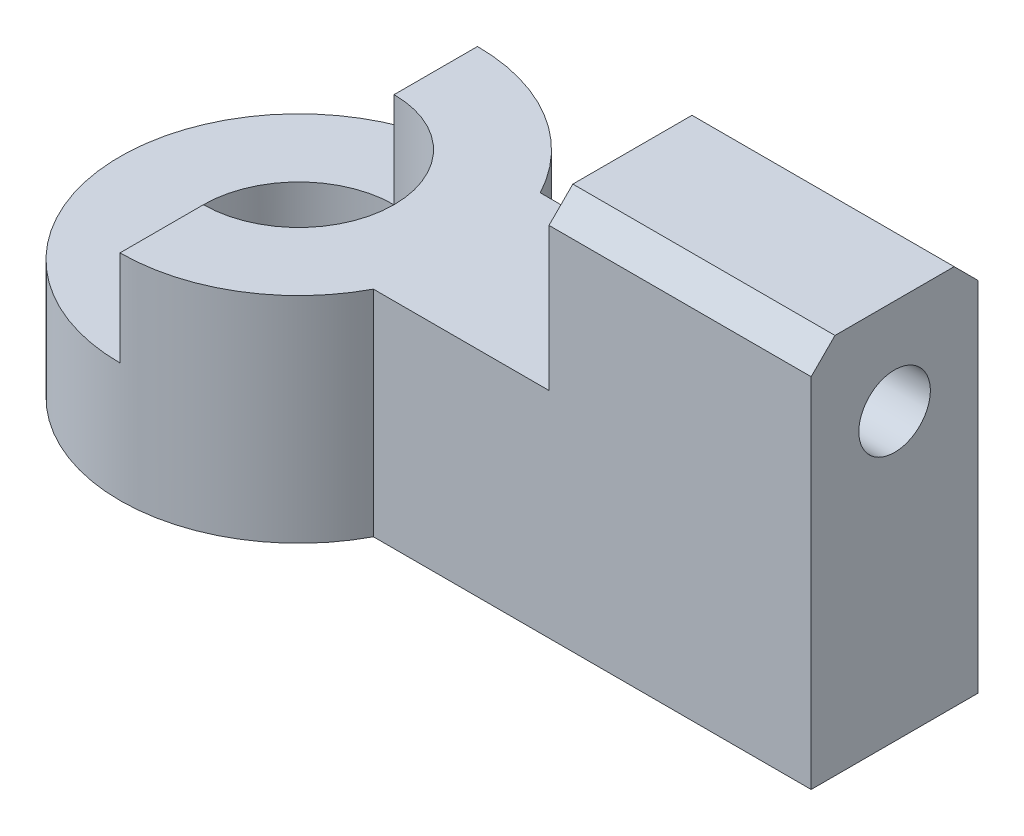
from build123d import *

# Parameters (mm, degrees)
SKETCH1_R           = 8
BOSS_EXTRUDE1_DEPTH = 10
BOSS_EXTRUDE2_DEPTH = 18
SKETCH1_4_W         = 22
SKETCH1_4_H         = 14
BOSS_EXTRUDE3_DEPTH = 32
CHAMFER1_SIZE       = 2
SKETCH2_R           = 3
CUT_EXTRUDE1_DEPTH  = 56.6596802


with BuildPart() as part:
    # Sketch1 → Boss-Extrude1 (new body)
    with BuildSketch(Plane(origin=(0, 0, 0), x_dir=(1, 0, 0), z_dir=(0, 1, 0))):
        with BuildLine():
            ThreePointArc((13.266499161, 7), (-15, 0), (13.266499161, -7))
            Line((13.266499161, -7), (50, -7))
            Line((50, -7), (50, 7))
            Line((50, 7), (13.266499161, 7))
        make_face()
        Circle(SKETCH1_R, mode=Mode.SUBTRACT)
    extrude(amount=BOSS_EXTRUDE1_DEPTH)

    # Sketch1<3> → Boss-Extrude2 (add)
    with BuildSketch(Plane(origin=(0, 0, 0), x_dir=(1, 0, 0), z_dir=(0, 1, 0))):
        with BuildLine():
            ThreePointArc((13.266499161, 7), (7.745966692, 12.845232579), (0, 15))
            Line((0, 15), (0, 8))
            ThreePointArc((0, 8), (8, 0), (0, -8))
            Line((0, -8), (0, -15))
            ThreePointArc((0, -15), (7.745966692, -12.845232579), (13.266499161, -7))
            Line((13.266499161, -7), (50, -7))
            Line((50, -7), (50, 7))
            Line((50, 7), (13.266499161, 7))
        make_face()
    extrude(amount=BOSS_EXTRUDE2_DEPTH)

    # Sketch1<4> → Boss-Extrude3 (add)
    with BuildSketch(Plane(origin=(0, 0, 0), x_dir=(1, 0, 0), z_dir=(0, 1, 0))):
        with Locations((39, 0)):
            Rectangle(SKETCH1_4_W, SKETCH1_4_H)
    extrude(amount=BOSS_EXTRUDE3_DEPTH)

    # Chamfer1
    chamfer1_edges = [part.edges().sort_by_distance(p)[0] for p in [
        (39, 32, -7),
        (39, 32, 7),
    ]]
    chamfer(chamfer1_edges, length=CHAMFER1_SIZE)

    # Sketch2 → Cut-Extrude1 (cut, through all)
    with BuildSketch(Plane.ZY.offset(-28)):
        with Locations((0, 24)):
            Circle(SKETCH2_R)
    extrude(amount=-CUT_EXTRUDE1_DEPTH, mode=Mode.SUBTRACT)


solid = part.part
